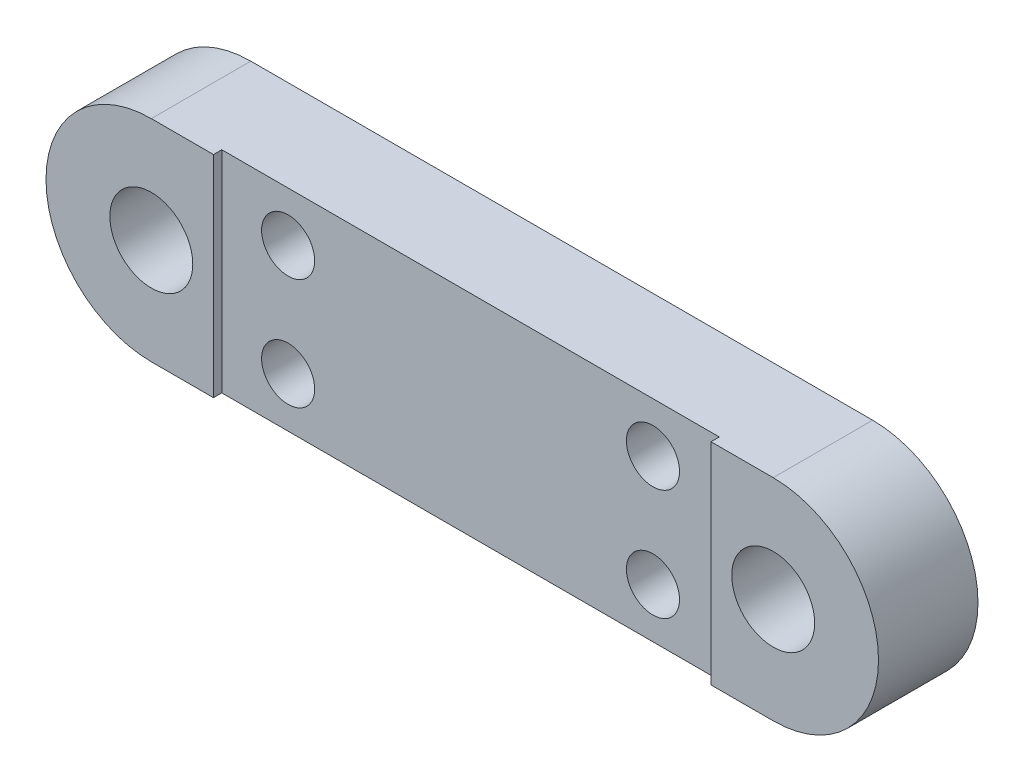
from build123d import *

# Parameters (mm, degrees)
CROQUIS1_R              = 5
SALIENTE_EXTRUIR1_DEPTH = 12
CROQUIS2_R              = 4
CORTAR_EXTRUIR1_DEPTH   = 21
CROQUIS3_W              = 60
CROQUIS3_H              = 34
CORTAR_EXTRUIR4_DEPTH   = 1
CROQUIS5_R              = 3.2
CORTAR_EXTRUIR5_DEPTH   = 90.423598675


with BuildPart() as part:
    # Croquis1 → Saliente-Extruir1 (new body)
    with BuildSketch(Plane.XY):
        with BuildLine():
            Line((0, 12.7), (75, 12.7))
            ThreePointArc((75, 12.7), (87.7, 0), (75, -12.7))
            Line((75, -12.7), (0, -12.7))
            ThreePointArc((0, -12.7), (-12.7, 0), (0, 12.7))
        make_face()
        Circle(CROQUIS1_R, mode=Mode.SUBTRACT)
        with Locations((75, 0)):
            Circle(CROQUIS1_R, mode=Mode.SUBTRACT)
    extrude(amount=SALIENTE_EXTRUIR1_DEPTH)

    # Croquis2 → Cortar-Extruir1 (cut)
    with BuildSketch(Plane.XZ.offset(12.7)):
        with Locations(Location((37.5, 6, 0), (0, 0, 270))):
            Circle(CROQUIS2_R)
    extrude(amount=-CORTAR_EXTRUIR1_DEPTH, mode=Mode.SUBTRACT)

    # Croquis3 → Cortar-Extruir4 (cut)
    with BuildSketch(Plane.XY.offset(12)):
        with Locations((37.5, 0)):
            Rectangle(CROQUIS3_W, CROQUIS3_H)
    extrude(amount=-CORTAR_EXTRUIR4_DEPTH, mode=Mode.SUBTRACT)

    # Croquis5 → Cortar-Extruir5 (cut, through all)
    with BuildSketch(Plane.XY.offset(12)):
        with Locations((59.5, -6.7)):
            Circle(CROQUIS5_R)
        with Locations((59.5, 6.7)):
            Circle(CROQUIS5_R)
        with Locations((15.5, 6.7)):
            Circle(CROQUIS5_R)
        with Locations((15.5, -6.7)):
            Circle(CROQUIS5_R)
    extrude(amount=-CORTAR_EXTRUIR5_DEPTH, mode=Mode.SUBTRACT)


solid = part.part
